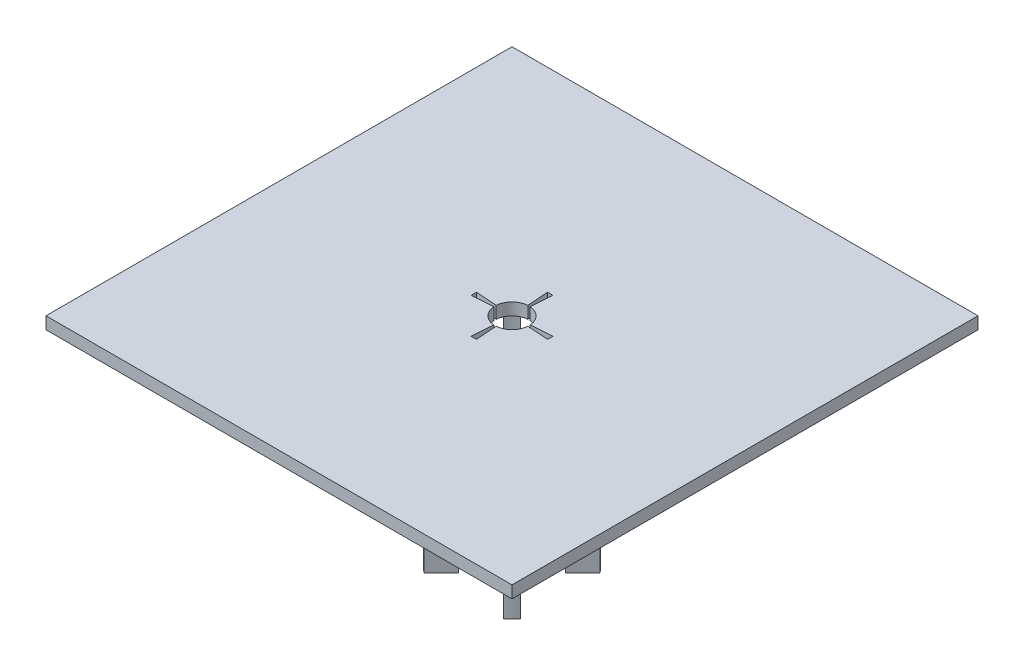
from build123d import *

# Parameters (mm, degrees)
SKETCH2_W           = 38.37
SKETCH2_H           = 38.37
BOSS_EXTRUDE6_DEPTH = 1
BOSS_EXTRUDE7_START = -17
BOSS_EXTRUDE7_DEPTH = 17


with BuildPart() as part:
    # Sketch2 → Boss-Extrude6 (new body)
    # profile 1 of 5: a face of its own
    with BuildSketch(Plane(origin=(0, 0, 0), x_dir=(1, 0, 0), z_dir=(0, 1, 0))):
        Rectangle(SKETCH2_W, SKETCH2_H)
        with BuildLine():
            Line((-3.976901657, -3.269794876), (-2.550972937, -1.843866156))
            ThreePointArc((-2.550972937, -1.843866156), (-2.22568027, -2.22568027), (-1.843866156, -2.550972937))
            Line((-1.843866156, -2.550972937), (-3.269794876, -3.976901657))
            ThreePointArc((-3.269794876, -3.976901657), (-3.640556642, -3.640556642), (-3.976901657, -3.269794876))
        make_face(mode=Mode.SUBTRACT)
        with BuildLine():
            Line((3.269794876, -3.976901657), (1.843866156, -2.550972937))
            ThreePointArc((1.843866156, -2.550972937), (2.22568027, -2.22568027), (2.550972937, -1.843866156))
            Line((2.550972937, -1.843866156), (3.976901657, -3.269794876))
            ThreePointArc((3.976901657, -3.269794876), (3.640556642, -3.640556642), (3.269794876, -3.976901657))
        make_face(mode=Mode.SUBTRACT)
        with BuildLine():
            ThreePointArc((-1.39658967, 0.097659063), (-0.989949494, 0.989949494), (-0.097659063, 1.39658967))
            Line((-0.097659063, 1.39658967), (-0.219564585, 3.139919858))
            ThreePointArc((-0.219564585, 3.139919858), (0, 3.147587223), (0.219564585, 3.139919858))
            Line((0.219564585, 3.139919858), (0.097659063, 1.39658967))
            ThreePointArc((0.097659063, 1.39658967), (0.989949494, 0.989949494), (1.39658967, 0.097659063))
            Line((1.39658967, 0.097659063), (3.139919858, 0.219564585))
            ThreePointArc((3.139919858, 0.219564585), (3.147587223, 0), (3.139919858, -0.219564585))
            Line((3.139919858, -0.219564585), (1.39658967, -0.097659063))
            ThreePointArc((1.39658967, -0.097659063), (0.989949494, -0.989949494), (0.097659063, -1.39658967))
            Line((0.097659063, -1.39658967), (0.219564585, -3.139919858))
            ThreePointArc((0.219564585, -3.139919858), (0, -3.147587223), (-0.219564585, -3.139919858))
            Line((-0.219564585, -3.139919858), (-0.097659063, -1.39658967))
            ThreePointArc((-0.097659063, -1.39658967), (-0.989949494, -0.989949494), (-1.39658967, -0.097659063))
            Line((-1.39658967, -0.097659063), (-3.139919858, -0.219564585))
            ThreePointArc((-3.139919858, -0.219564585), (-3.147587223, 0), (-3.139919858, 0.219564585))
            Line((-3.139919858, 0.219564585), (-1.39658967, 0.097659063))
        make_face(mode=Mode.SUBTRACT)
        with BuildLine():
            Line((-3.269794876, 3.976901657), (-1.843866156, 2.550972937))
            ThreePointArc((-1.843866156, 2.550972937), (-2.22568027, 2.22568027), (-2.550972937, 1.843866156))
            Line((-2.550972937, 1.843866156), (-3.976901657, 3.269794876))
            ThreePointArc((-3.976901657, 3.269794876), (-3.640556642, 3.640556642), (-3.269794876, 3.976901657))
        make_face(mode=Mode.SUBTRACT)
        with BuildLine():
            Line((3.976901657, 3.269794876), (2.550972937, 1.843866156))
            ThreePointArc((2.550972937, 1.843866156), (2.22568027, 2.22568027), (1.843866156, 2.550972937))
            Line((1.843866156, 2.550972937), (3.269794876, 3.976901657))
            ThreePointArc((3.269794876, 3.976901657), (3.640556642, 3.640556642), (3.976901657, 3.269794876))
        make_face(mode=Mode.SUBTRACT)
    # profile 2 of 5: a face of its own
    with BuildSketch(Plane(origin=(0, 0, 0), x_dir=(1, 0, 0), z_dir=(0, 1, 0))):
        with BuildLine():
            ThreePointArc((-3.269794876, -3.976901657), (-3.640556642, -3.640556642), (-3.976901657, -3.269794876))
            Line((-3.976901657, -3.269794876), (-2.550972937, -1.843866156))
            ThreePointArc((-2.550972937, -1.843866156), (-2.22568027, -2.22568027), (-1.843866156, -2.550972937))
            Line((-1.843866156, -2.550972937), (-3.269794876, -3.976901657))
        make_face()
    # profile 3 of 5: a face of its own
    with BuildSketch(Plane(origin=(0, 0, 0), x_dir=(1, 0, 0), z_dir=(0, 1, 0))):
        with BuildLine():
            Line((-2.550972937, 1.843866156), (-3.976901657, 3.269794876))
            ThreePointArc((-3.976901657, 3.269794876), (-3.640556642, 3.640556642), (-3.269794876, 3.976901657))
            Line((-3.269794876, 3.976901657), (-1.843866156, 2.550972937))
            ThreePointArc((-1.843866156, 2.550972937), (-2.22568027, 2.22568027), (-2.550972937, 1.843866156))
        make_face()
    # profile 4 of 5: a face of its own
    with BuildSketch(Plane(origin=(0, 0, 0), x_dir=(1, 0, 0), z_dir=(0, 1, 0))):
        with BuildLine():
            ThreePointArc((3.269794876, 3.976901657), (3.640556642, 3.640556642), (3.976901657, 3.269794876))
            Line((3.976901657, 3.269794876), (2.550972937, 1.843866156))
            ThreePointArc((2.550972937, 1.843866156), (2.22568027, 2.22568027), (1.843866156, 2.550972937))
            Line((1.843866156, 2.550972937), (3.269794876, 3.976901657))
        make_face()
    # profile 5 of 5: a face of its own
    with BuildSketch(Plane(origin=(0, 0, 0), x_dir=(1, 0, 0), z_dir=(0, 1, 0))):
        with BuildLine():
            ThreePointArc((3.976901657, -3.269794876), (3.640556642, -3.640556642), (3.269794876, -3.976901657))
            Line((3.269794876, -3.976901657), (1.843866156, -2.550972937))
            ThreePointArc((1.843866156, -2.550972937), (2.22568027, -2.22568027), (2.550972937, -1.843866156))
            Line((2.550972937, -1.843866156), (3.976901657, -3.269794876))
        make_face()
    extrude(amount=BOSS_EXTRUDE6_DEPTH)

    # Sketch7 → Boss-Extrude7 (add)
    with BuildSketch(Plane(origin=(0, 0, 0), x_dir=(1, 0, 0), z_dir=(0, 1, 0)).offset(BOSS_EXTRUDE7_START)):
        with BuildLine():
            Line((-3.976901657, 3.269794876), (-2.550972937, 1.843866156))
            ThreePointArc((-2.550972937, 1.843866156), (-2.22568027, 2.22568027), (-1.843866156, 2.550972937))
            Line((-1.843866156, 2.550972937), (-3.269794876, 3.976901657))
            ThreePointArc((-3.269794876, 3.976901657), (-3.640556642, 3.640556642), (-3.976901657, 3.269794876))
        make_face()
        with BuildLine():
            ThreePointArc((-1.843866156, -2.550972937), (-2.22568027, -2.22568027), (-2.550972937, -1.843866156))
            Line((-2.550972937, -1.843866156), (-3.976901657, -3.269794876))
            ThreePointArc((-3.976901657, -3.269794876), (-3.640556642, -3.640556642), (-3.269794876, -3.976901657))
            Line((-3.269794876, -3.976901657), (-1.843866156, -2.550972937))
        make_face()
        with BuildLine():
            Line((3.269794876, 3.976901657), (1.843866156, 2.550972937))
            ThreePointArc((1.843866156, 2.550972937), (2.22568027, 2.22568027), (2.550972937, 1.843866156))
            Line((2.550972937, 1.843866156), (3.976901657, 3.269794876))
            ThreePointArc((3.976901657, 3.269794876), (3.640556642, 3.640556642), (3.269794876, 3.976901657))
        make_face()
        with BuildLine():
            ThreePointArc((2.550972937, -1.843866156), (2.22568027, -2.22568027), (1.843866156, -2.550972937))
            Line((1.843866156, -2.550972937), (3.269794876, -3.976901657))
            ThreePointArc((3.269794876, -3.976901657), (3.640556642, -3.640556642), (3.976901657, -3.269794876))
            Line((3.976901657, -3.269794876), (2.550972937, -1.843866156))
        make_face()
    extrude(amount=BOSS_EXTRUDE7_DEPTH)


solid = part.part
